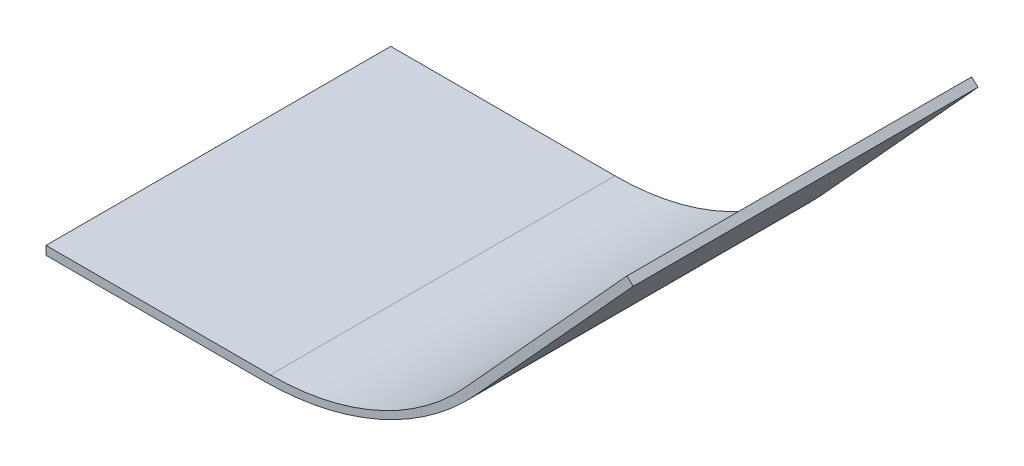
from build123d import *

# Parameters (mm, degrees)
BOSS_EXTRUDE1_DEPTH = 20


with BuildPart() as part:
    # Sketch2 → Boss-Extrude1 (new body)
    with BuildSketch(Plane.XY):
        with BuildLine():
            Line((-10, 0.25), (-10, -0.25))
            Line((-10, -0.25), (2.558559359, -0.25))
            ThreePointArc((2.558559359, -0.25), (9.330943439, 1.178636102), (14.949201571, 5.221081253))
            Line((14.949201571, 5.221081253), (24.073764845, 15.230460925))
            Line((24.073764845, 15.230460925), (23.704256858, 15.567304877))
            Line((23.704256858, 15.567304877), (14.272626208, 5.221081253))
            ThreePointArc((14.272626208, 5.221081253), (9.167818514, 1.548073601), (3.014359997, 0.25))
            Line((3.014359997, 0.25), (-10, 0.25))
        make_face()
    extrude(amount=-BOSS_EXTRUDE1_DEPTH)


solid = part.part
